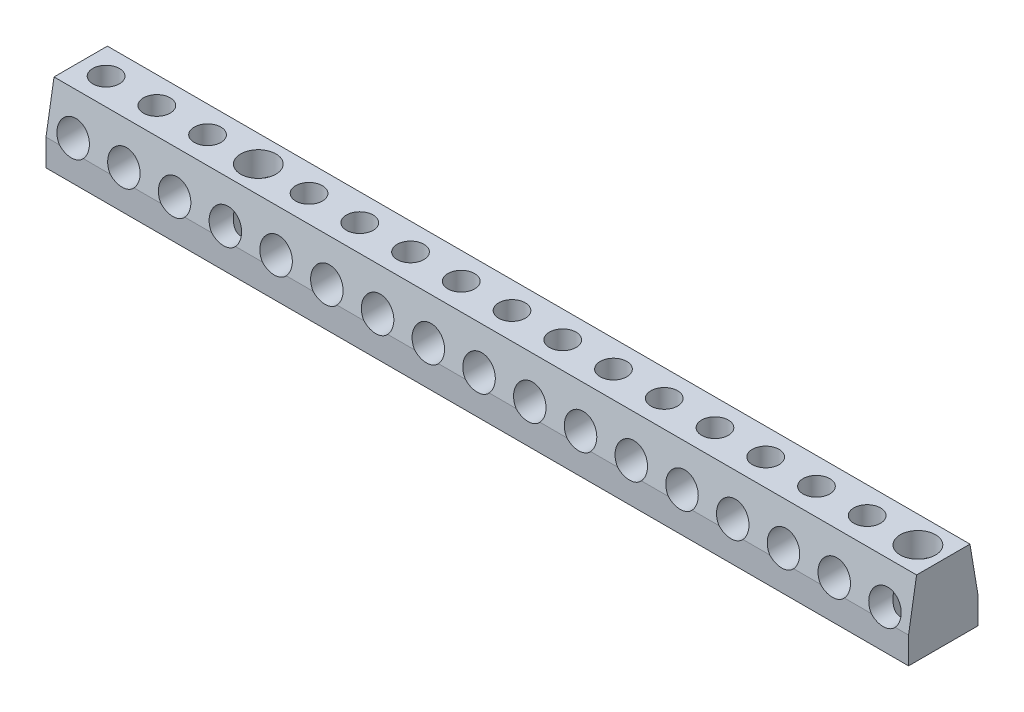
from build123d import *

# Parameters (mm, degrees)
BOSS_EXTRUDE1_DEPTH        = 80.75
SKETCH2_R                  = 3
CUT_EXTRUDE1_DEPTH         = 83.2119973
M6X1_0_TAPPED_HOLE1_REACH  = 84.212
M6X1_0_TAPPED_HOLE1_BORE_R = 2.5
LPATTERN1_COUNT            = 17
LPATTERN1_PITCH            = 9.5
M6_CLEARANCE_HOLE1_D       = 6.6


with BuildPart() as part:
    # Sketch1 → Boss-Extrude1 (new, symmetric)
    with BuildSketch(Plane(origin=(0, 0, 0), x_dir=(0, 0, -1), z_dir=(1, 0, 0))):
        Polygon((6.5, 0), (-6.5, 0), (-6.5, 5), (-5, 14), (5, 14), (6.5, 5), align=None)
    extrude(amount=BOSS_EXTRUDE1_DEPTH, both=True)

    # Sketch2 → Cut-Extrude1 (cut, symmetric)
    with BuildSketch(Plane.XY):
        with Locations(Location((-76, 7, 0), (0, 0, 318.189685104))):
            Circle(SKETCH2_R)
    cut_extrude1 = extrude(amount=CUT_EXTRUDE1_DEPTH, both=True, mode=Mode.SUBTRACT)

    # M6x1.0 Tapped Hole1 bore → M6x1.0 Tapped Hole1 (cut, up to next)
    with BuildSketch(Plane(origin=(0, 14, 0), x_dir=(1, 0, 0), z_dir=(0, 1, 0)), mode=Mode.PRIVATE) as m6x1_0_tapped_hole1_sk1:
        with Locations((-76, 0)):
            Circle(M6X1_0_TAPPED_HOLE1_BORE_R)
    m6x1_0_tapped_hole1_tool1 = extrude(m6x1_0_tapped_hole1_sk1.sketch, amount=-M6X1_0_TAPPED_HOLE1_REACH, mode=Mode.PRIVATE) & part.part
    m6x1_0_tapped_hole1 = m6x1_0_tapped_hole1_tool1.solids().sort_by_distance((-76, 14, 0))[0]
    add(m6x1_0_tapped_hole1, mode=Mode.SUBTRACT)

    # LPattern1: Cut-Extrude1, M6x1.0 Tapped Hole1 ×17
    with Locations(*[(i * LPATTERN1_PITCH, 0, 0) for i in range(1, LPATTERN1_COUNT)]):
        add(cut_extrude1, mode=Mode.SUBTRACT)
        add(m6x1_0_tapped_hole1, mode=Mode.SUBTRACT)

    # M6 Clearance Hole1 (through all)
    with Locations(Plane(origin=(0, 14, 0), x_dir=(1, 0, 0), z_dir=(0, 1, 0))):
        with Locations((-47.5, 0), (76, 0)):
            Hole(M6_CLEARANCE_HOLE1_D / 2)


solid = part.part
